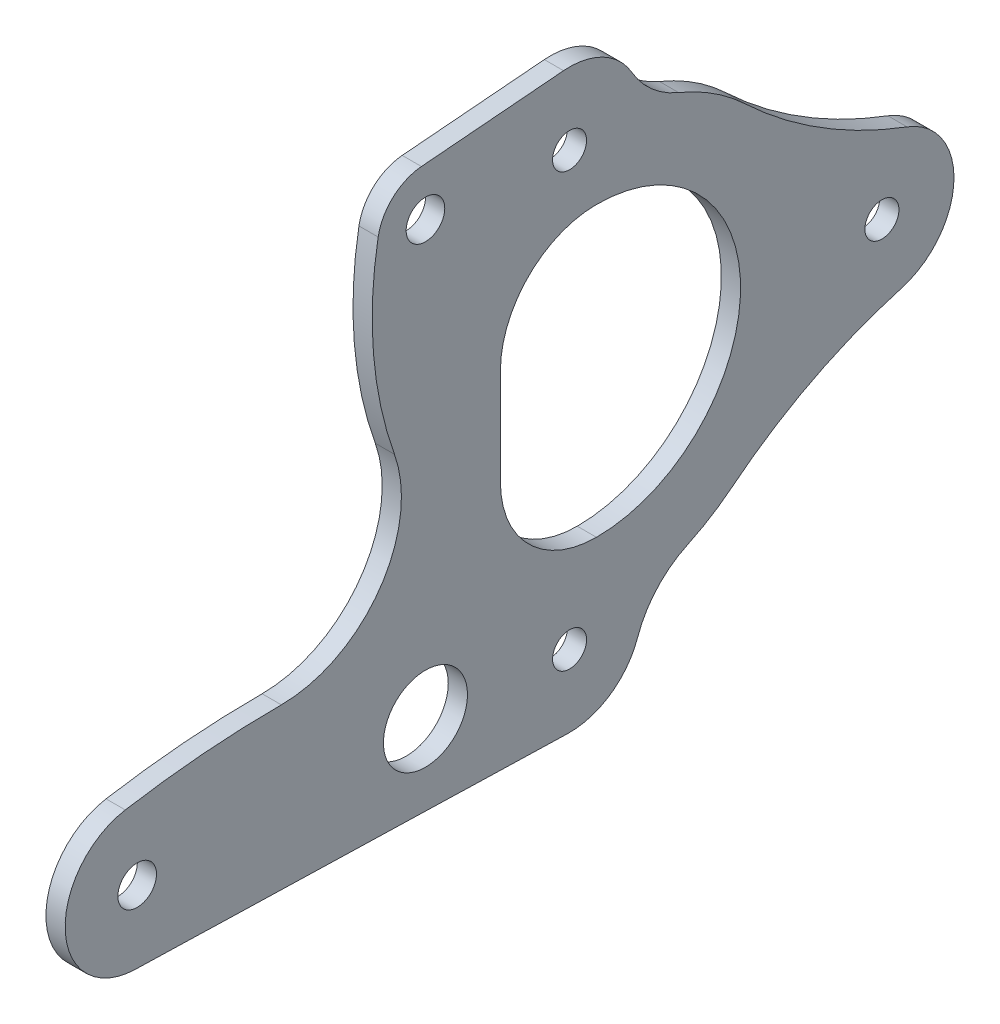
from build123d import *

# Parameters (mm, degrees)
BOSS_EXTRUDE1_DEPTH            = 2.54
F_7_16_0_4375_DIAMETER_HOLE1_D = 11.1125
F_8_CLEARANCE_HOLE2_D          = 4.4958
F_10_CLEARANCE_HOLE2_D         = 5.1054


with BuildPart() as part:
    # Sketch1 → Boss-Extrude1 (new body)
    with BuildSketch(Plane(origin=(0, 0, 0), x_dir=(0, 0, -1), z_dir=(1, 0, 0))):
        with BuildLine():
            Line((-19.314481315, -36.508827357), (37.835518685, -38.096327357))
            ThreePointArc((37.835518685, -38.096327357), (43.508241138, -36.415698489), (47.094324235, -31.709925286))
            ThreePointArc((47.094324235, -31.709925286), (49.666291071, -27.372500374), (53.723446842, -24.377879309))
            ThreePointArc((53.723446842, -24.377879309), (56.748764885, -22.739945951), (59.555317673, -20.750313723))
            ThreePointArc((59.555317673, -20.750313723), (70.190449205, -13.830311686), (81.989075544, -9.162885478))
            ThreePointArc((81.989075544, -9.162885478), (88.904940009, -0.38440552), (82.719582069, 8.923238587))
            ThreePointArc((82.719582069, 8.923238587), (71.335814009, 14.527011927), (61.293419407, 22.282188362))
            ThreePointArc((61.293419407, 22.282188362), (57.164774633, 25.524177799), (52.512741108, 27.956211363))
            ThreePointArc((52.512741108, 27.956211363), (48.982518098, 30.139520785), (46.344839733, 33.344511796))
            ThreePointArc((46.344839733, 33.344511796), (42.509528769, 37.017847922), (37.303469713, 38.066636556))
            Line((37.303469713, 38.066636556), (18.518979809, 36.490257704))
            ThreePointArc((18.518979809, 36.490257704), (14.772389284, 34.855531703), (12.798400928, 31.276056933))
            ThreePointArc((12.798400928, 31.276056933), (12.18571912, 18.160305029), (14.955046072, 5.325619398))
            ThreePointArc((14.955046072, 5.325619398), (12.972274915, -9.150721749), (0, -15.875))
            ThreePointArc((0, -15.875), (-10.349023893, -16.30546329), (-20.626551724, -17.59387931))
            ThreePointArc((-20.626551724, -17.59387931), (-28.552166362, -27.646635371), (-19.314481315, -36.508827357))
        make_face()
        with BuildLine():
            Line((28.956, 7.874), (28.956, -4.826))
            ThreePointArc((28.956, -4.826), (32.675743879, -13.806256121), (41.656, -17.526))
            ThreePointArc((41.656, -17.526), (60.706, 1.524), (41.656, 20.574))
            ThreePointArc((41.656, 20.574), (32.675743879, 16.854256121), (28.956, 7.874))
        make_face(mode=Mode.SUBTRACT)
    extrude(amount=BOSS_EXTRUDE1_DEPTH)

    # 7/16 (0.4375) Diameter Hole1 (through all)
    with Locations(Plane(origin=(2.54, 0, 0), x_dir=(0, 0, -1), z_dir=(1, 0, 0))):
        with Locations((19.05, -26.9875)):
            Hole(F_7_16_0_4375_DIAMETER_HOLE1_D / 2)

    # #8 Clearance Hole2 (through all)
    with Locations(Plane(origin=(2.54, 0, 0), x_dir=(0, 0, -1), z_dir=(1, 0, 0))):
        with Locations((38.1, -28.575), (79.3877, 0), (38.1, 28.575)):
            Hole(F_8_CLEARANCE_HOLE2_D / 2)

    # #10 Clearance Hole2 (through all)
    with Locations(Plane(origin=(2.54, 0, 0), x_dir=(0, 0, -1), z_dir=(1, 0, 0))):
        with Locations((-19.05, -26.9875), (19.05, 30.1625)):
            Hole(F_10_CLEARANCE_HOLE2_D / 2)


solid = part.part
